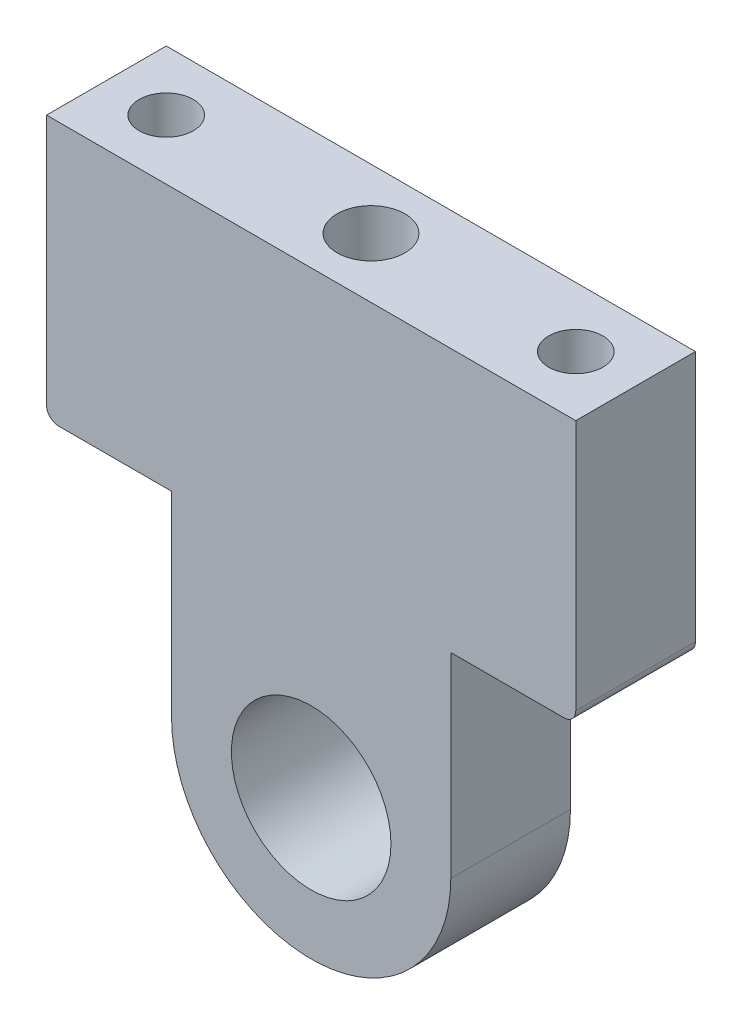
from build123d import *

# Parameters (mm, degrees)
SKETCH1_R           = 10
BOSS_EXTRUDE1_DEPTH = 15
SKETCH2_R           = 3.4
CUT_EXTRUDE1_DEPTH  = 54
SKETCH3_R           = 4.25
CUT_EXTRUDE2_DEPTH  = 28
FILLET1_R           = 1.5


with BuildPart() as part:
    # Sketch1 → Boss-Extrude1 (new body)
    with BuildSketch(Plane.XY):
        with BuildLine():
            Line((0, 0), (0, 33))
            Line((0, 33), (66.33, 33))
            Line((66.33, 33), (66.33, 0))
            Line((66.33, 0), (50.665, 0))
            Line((50.665, 0), (50.665, -24.529))
            ThreePointArc((50.665, -24.529), (33.165, -42.029), (15.665, -24.529))
            Line((15.665, -24.529), (15.665, 0))
            Line((15.665, 0), (0, 0))
        make_face()
        with Locations((33.165, -24.529)):
            Circle(SKETCH1_R, mode=Mode.SUBTRACT)
    extrude(amount=BOSS_EXTRUDE1_DEPTH)

    # Sketch2 → Cut-Extrude1 (cut)
    with BuildSketch(Plane(origin=(0, 33, 0), x_dir=(1, 0, 0), z_dir=(0, 1, 0))):
        with Locations(Location((58.831, -7.5, 0), (0, 0, 270))):
            Circle(SKETCH2_R)
        with Locations(Location((7.499, -7.5, 0), (0, 0, 180))):
            Circle(SKETCH2_R)
    extrude(amount=-CUT_EXTRUDE1_DEPTH, mode=Mode.SUBTRACT)

    # Sketch3 → Cut-Extrude2 (cut)
    with BuildSketch(Plane(origin=(0, 33, 0), x_dir=(1, 0, 0), z_dir=(0, 1, 0))):
        with Locations(Location((33.165, -7.5, 0), (0, 0, 270))):
            Circle(SKETCH3_R)
    extrude(amount=-CUT_EXTRUDE2_DEPTH, mode=Mode.SUBTRACT)

    # Fillet1
    fillet1_edges = [part.edges().sort_by_distance(p)[0] for p in [
        (0, 0, 7.5),
        (66.33, 0, 7.5),
    ]]
    fillet(fillet1_edges, radius=FILLET1_R)


solid = part.part
